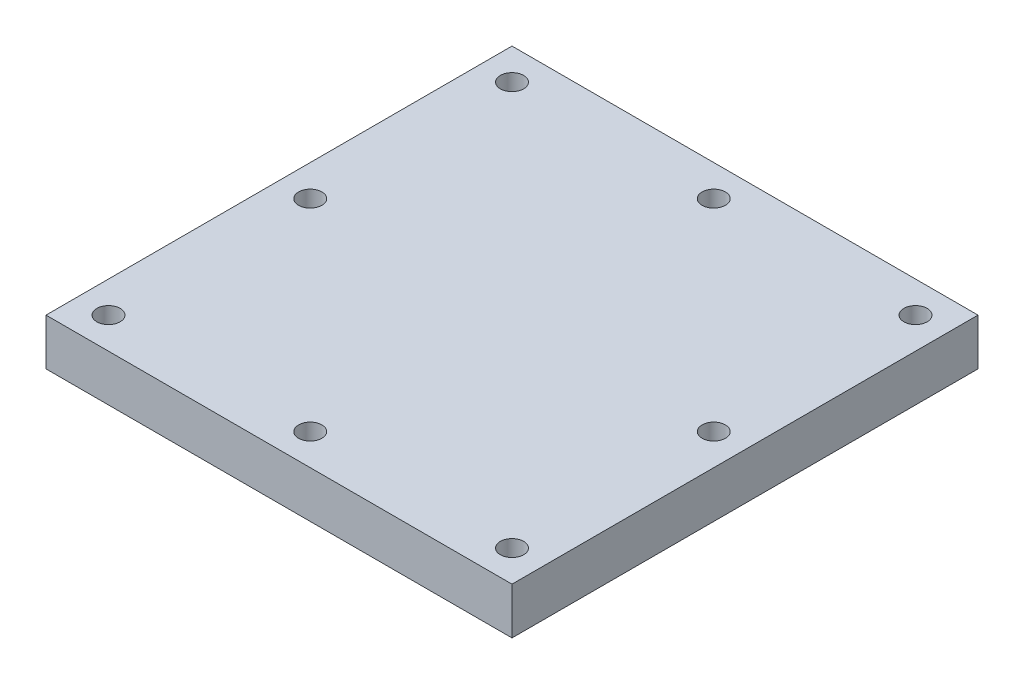
from build123d import *

# Parameters (mm, degrees)
SKETCH2_W           = 1000
SKETCH2_H           = 1000
SKETCH2_R           = 25
BOSS_EXTRUDE1_DEPTH = 100


with BuildPart() as part:
    # Sketch2 → Boss-Extrude1 (new body)
    with BuildSketch(Plane(origin=(0, 0, 0), x_dir=(1, 0, 0), z_dir=(0, 1, 0))):
        Rectangle(SKETCH2_W, SKETCH2_H)
        with Locations(Location((432.95148248, 432.95148248, 0), (0, 0, 270))):
            Circle(SKETCH2_R, mode=Mode.SUBTRACT)
        with Locations(Location((-432.95148248, 432.95148248, 0), (0, 0, 270))):
            Circle(SKETCH2_R, mode=Mode.SUBTRACT)
        with Locations(Location((-432.95148248, -432.95148248, 0), (0, 0, 270))):
            Circle(SKETCH2_R, mode=Mode.SUBTRACT)
        with Locations(Location((432.95148248, -432.95148248, 0), (0, 0, 270))):
            Circle(SKETCH2_R, mode=Mode.SUBTRACT)
        with Locations(Location((-432.95148248, 0, 0), (0, 0, 270))):
            Circle(SKETCH2_R, mode=Mode.SUBTRACT)
        with Locations(Location((432.95148248, 0, 0), (0, 0, 270))):
            Circle(SKETCH2_R, mode=Mode.SUBTRACT)
        with Locations(Location((0, 432.95148248, 0), (0, 0, 270))):
            Circle(SKETCH2_R, mode=Mode.SUBTRACT)
        with Locations(Location((0, -432.95148248, 0), (0, 0, 270))):
            Circle(SKETCH2_R, mode=Mode.SUBTRACT)
    extrude(amount=BOSS_EXTRUDE1_DEPTH)


solid = part.part
